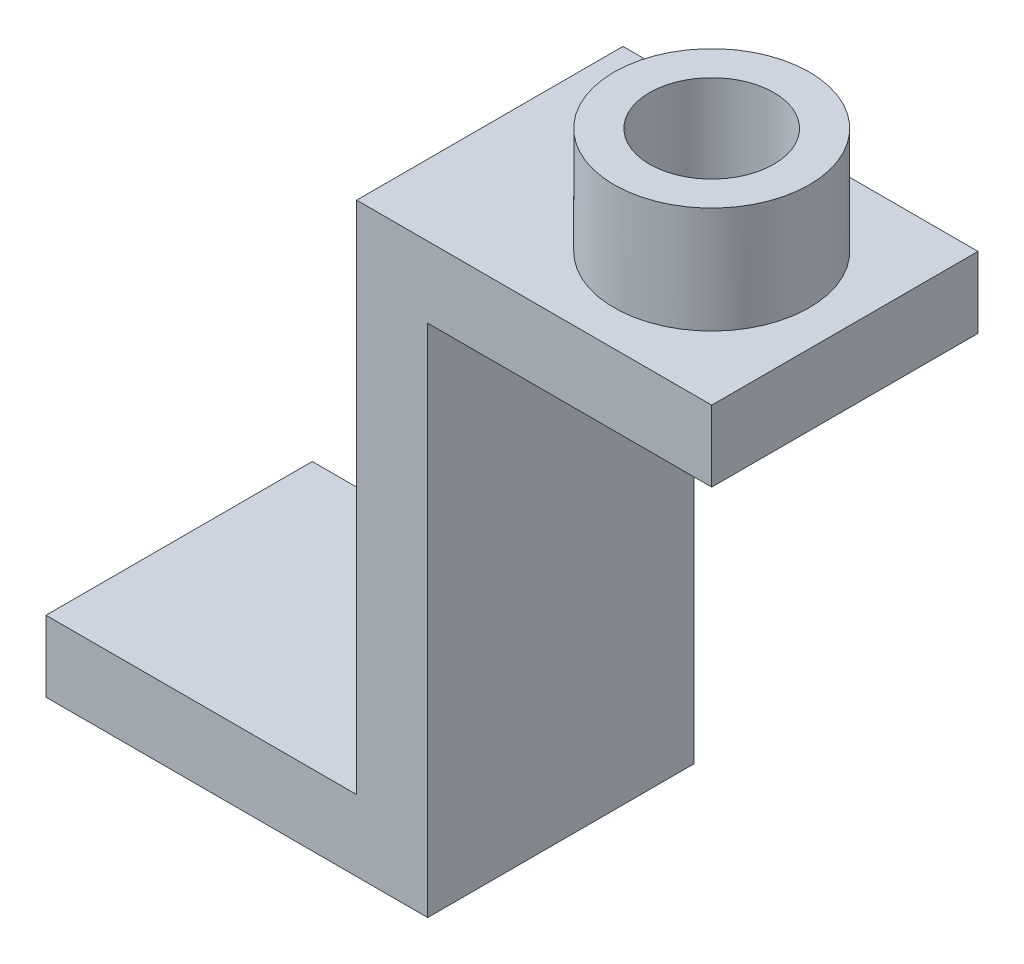
from build123d import *

# Parameters (mm, degrees)
BOSS_EXTRUDE3_DEPTH = 30
SKETCH6_R           = 11
SKETCH6_R_2         = 7
BOSS_EXTRUDE4_DEPTH = 12
CUT_EXTRUDE1_START  = -20
SKETCH7_R           = 7
CUT_EXTRUDE1_DEPTH  = 20


with BuildPart() as part:
    # Sketch3 → Boss-Extrude3 (new body)
    with BuildSketch(Plane.XY):
        Polygon((0, 8), (35, 8), (35, 66), (75, 66), (75, 58), (43, 58), (43, 0), (0, 0), align=None)
    extrude(amount=-BOSS_EXTRUDE3_DEPTH)

    # Sketch6 → Boss-Extrude4 (add)
    with BuildSketch(Plane(origin=(0, 66, 0), x_dir=(1, 0, 0), z_dir=(0, 1, 0))):
        with Locations(Location((60, 15, 0), (0, 0, 90))):
            Circle(SKETCH6_R)
        with Locations(Location((60, 15, 0), (0, 0, 270))):
            Circle(SKETCH6_R_2, mode=Mode.SUBTRACT)
    extrude(amount=BOSS_EXTRUDE4_DEPTH)

    # Sketch7 → Cut-Extrude1 (cut)
    with BuildSketch(Plane(origin=(0, 66, 0), x_dir=(1, 0, 0), z_dir=(0, 1, 0)).offset(CUT_EXTRUDE1_START)):
        with Locations(Location((60, 15, 0), (0, 0, 90))):
            Circle(SKETCH7_R)
    extrude(amount=CUT_EXTRUDE1_DEPTH, mode=Mode.SUBTRACT)


solid = part.part
